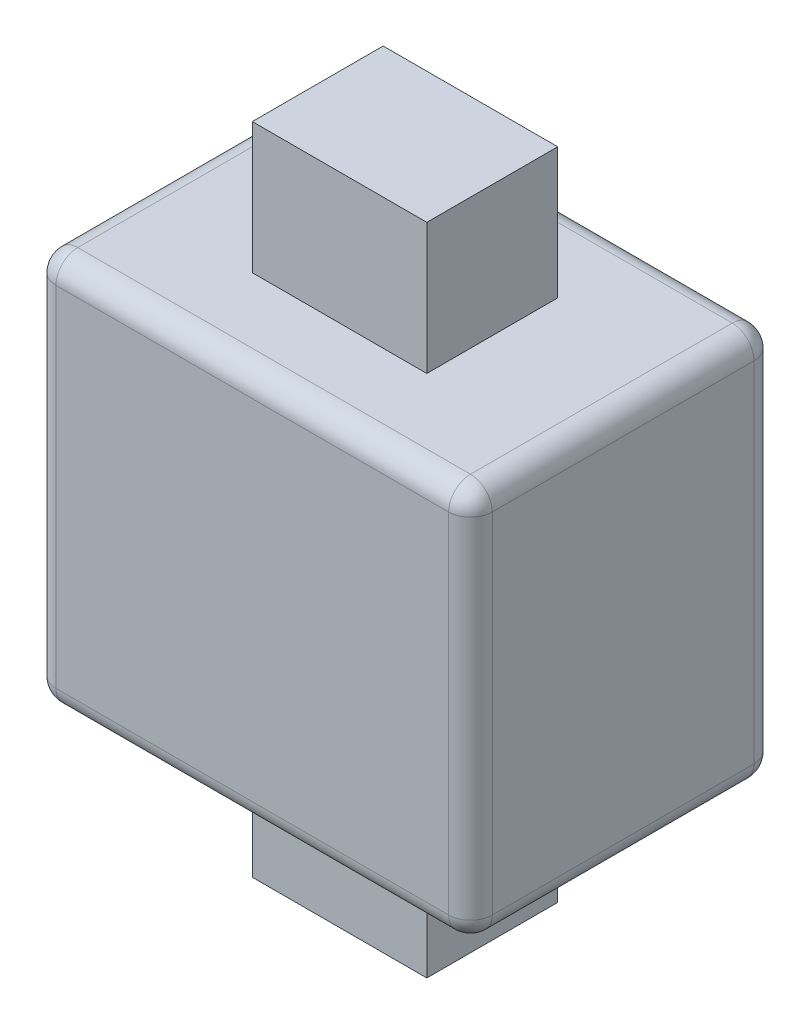
from build123d import *

# Parameters (mm, degrees)
SKETCH1_W           = 5
SKETCH1_H           = 4.5
BOSS_EXTRUDE1_DEPTH = 3.5
BOSS_EXTRUDE2_DEPTH = 1.5
BOSS_EXTRUDE3_DEPTH = 1.5
FILLET1_R           = 0.25


with BuildPart() as part:
    # Sketch1 → Boss-Extrude1 (new body)
    with BuildSketch(Plane.XY):
        Rectangle(SKETCH1_W, SKETCH1_H)
    extrude(amount=BOSS_EXTRUDE1_DEPTH)

    # Sketch2 → Boss-Extrude2 (add)
    with BuildSketch(Plane(origin=(0, 2.25, 0), x_dir=(1, 0, 0), z_dir=(0, 1, 0))):
        Polygon((-1, -2.45), (1, -1.05), (1, -1), (-1, -1), align=None)
        Polygon((1, -2.5), (1, -1.05), (-1, -2.45), (-1, -2.5), align=None)
    extrude(amount=BOSS_EXTRUDE2_DEPTH)

    # Sketch3 → Boss-Extrude3 (add)
    with BuildSketch(Plane(origin=(0, -2.25, 0), x_dir=(-1, 0, 0), z_dir=(0, -1, 0))):
        Polygon((-1, -1), (-1, -2.45), (1, -1.05), (1, -1), align=None)
        Polygon((1, -1.05), (-1, -2.45), (-1, -2.5), (1, -2.5), align=None)
    extrude(amount=BOSS_EXTRUDE3_DEPTH)

    # Fillet1
    fillet1_edges = [part.edges().sort_by_distance(p)[0] for p in [
        (-2.5, 0, 3.5),
        (0, -2.25, 3.5),
        (2.5, 0, 3.5),
        (0, -2.25, 0),
        (-2.5, 0, 0),
        (0, 2.25, 0),
        (2.5, 0, 0),
        (0, 2.25, 3.5),
        (2.5, -2.25, 1.75),
        (-2.5, -2.25, 1.75),
        (-2.5, 2.25, 1.75),
        (2.5, 2.25, 1.75),
    ]]
    fillet(fillet1_edges, radius=FILLET1_R)


solid = part.part
